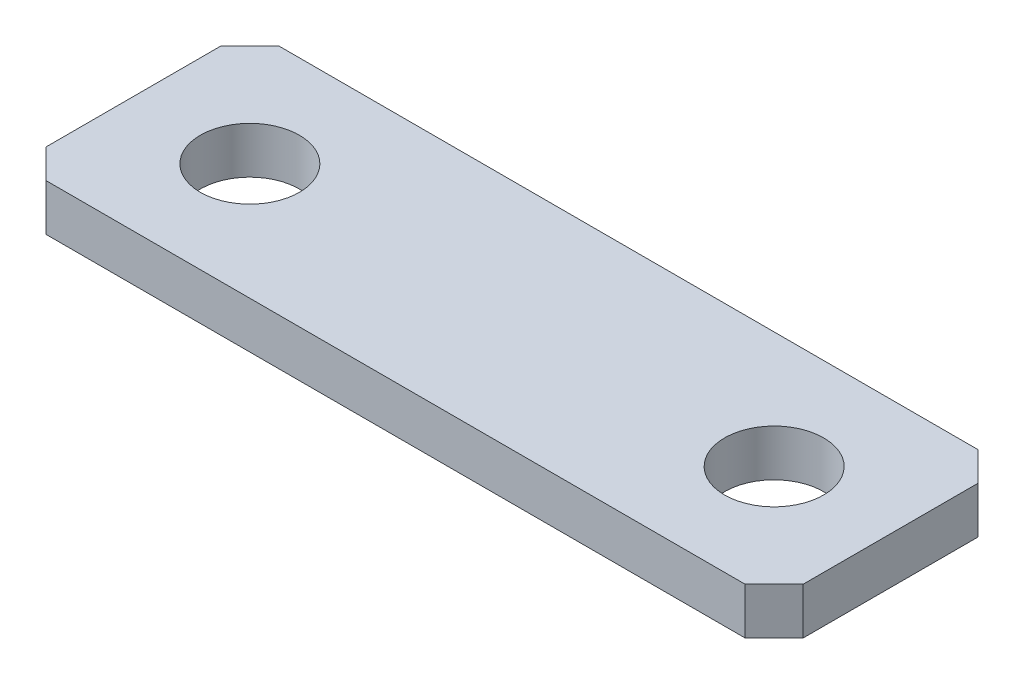
from build123d import *

# Parameters (mm, degrees)
SKETCH_1_W      = 130
SKETCH_1_H      = 40
SKETCH_1_R      = 8.5
EXTRUDE_1_DEPTH = 8
CHAMFER_1_SIZE  = 5


with BuildPart() as part:
    # 草图1 → 凸台-拉伸1 (new body)
    with BuildSketch(Plane(origin=(0, 0, 0), x_dir=(1, 0, 0), z_dir=(0, 1, 0))):
        with Locations((65, 20)):
            Rectangle(SKETCH_1_W, SKETCH_1_H)
        with Locations(Location((20, 20, 0), (0, 0, 270))):
            Circle(SKETCH_1_R, mode=Mode.SUBTRACT)
        with Locations(Location((110, 20, 0), (0, 0, 270))):
            Circle(SKETCH_1_R, mode=Mode.SUBTRACT)
    extrude(amount=EXTRUDE_1_DEPTH)

    # 倒角1
    chamfer_1_edges = [part.edges().sort_by_distance(p)[0] for p in [
        (0, 4, -40),
        (130, 4, -40),
        (130, 4, 0),
        (0, 4, 0),
    ]]
    chamfer(chamfer_1_edges, length=CHAMFER_1_SIZE)


solid = part.part
